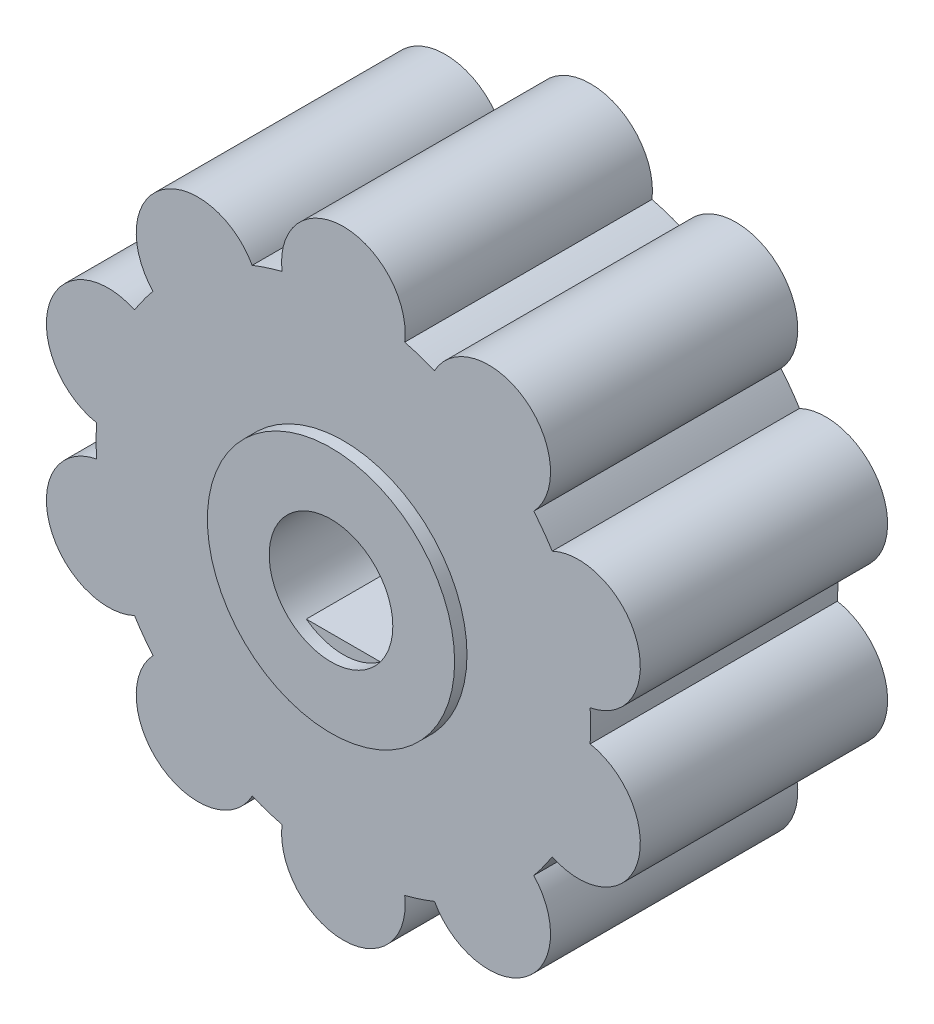
from build123d import *

# Parameters (mm, degrees)
SKIZZE1_R                            = 10
AUFSATZ_LINEAR_AUSTRAGEN1_DEPTH      = 10
AUFSATZ_LINEAR_AUSTRAGEN4_DEPTH      = 0.5
AUFSATZ_LINEAR_AUSTRAGEN4_DEPTH_BACK = 10.5
SKIZZE5_R                            = 5
SKIZZE2_R                            = 2.5
AUFSATZ_LINEAR_AUSTRAGEN2_DEPTH      = 10
KREISMUSTER1_COUNT                   = 10
SCHNITT_LINEAR_AUSTRAGEN1_DEPTH      = 0.5
SCHNITT_LINEAR_AUSTRAGEN1_DEPTH_BACK = 20
SKIZZE3_R                            = 2.5
SKIZZE4_W                            = 3.121683878
SKIZZE4_H                            = 1.135727963
AUFSATZ_LINEAR_AUSTRAGEN3_DEPTH      = 10


with BuildPart() as part:
    # Skizze1 → Aufsatz-Linear austragen1 (new body)
    with BuildSketch(Plane.XY):
        Circle(SKIZZE1_R)
    extrude(amount=AUFSATZ_LINEAR_AUSTRAGEN1_DEPTH)

    # Skizze5 → Aufsatz-Linear austragen4 (add, two sides: drawn at the far end of the back side and taken through both)
    with BuildSketch(Plane.XY.offset(10).offset(-AUFSATZ_LINEAR_AUSTRAGEN4_DEPTH_BACK)):
        Circle(SKIZZE5_R)
    extrude(amount=AUFSATZ_LINEAR_AUSTRAGEN4_DEPTH + AUFSATZ_LINEAR_AUSTRAGEN4_DEPTH_BACK)

    # Skizze2 → Aufsatz-Linear austragen2 (add)
    with BuildSketch(Plane(origin=(0, 0, 0), x_dir=(-1, 0, 0), z_dir=(0, 0, -1))):
        with Locations((0, 10)):
            Circle(SKIZZE2_R)
    aufsatz_linear_austragen2 = extrude(amount=-AUFSATZ_LINEAR_AUSTRAGEN2_DEPTH)

    # Kreismuster1: Aufsatz-Linear austragen2 ×10 about axis
    kreismuster1_axis = Axis((0, 0, 0), (0, 0, 1))
    for i in range(1, KREISMUSTER1_COUNT):
        add(aufsatz_linear_austragen2.rotate(kreismuster1_axis, i * 360 / KREISMUSTER1_COUNT))

    # Skizze3 → Schnitt-Linear austragen1 (cut, two sides: drawn at the far end of the back side and taken through both)
    with BuildSketch(Plane.XY.offset(10).offset(-SCHNITT_LINEAR_AUSTRAGEN1_DEPTH_BACK)):
        Circle(SKIZZE3_R)
    extrude(amount=SCHNITT_LINEAR_AUSTRAGEN1_DEPTH + SCHNITT_LINEAR_AUSTRAGEN1_DEPTH_BACK, mode=Mode.SUBTRACT)

    # Skizze4 → Aufsatz-Linear austragen3 (add)
    with BuildSketch(Plane.XY.offset(10)):
        with Locations((0.060841939, -2.567863982)):
            Rectangle(SKIZZE4_W, SKIZZE4_H)
    extrude(amount=-AUFSATZ_LINEAR_AUSTRAGEN3_DEPTH)


solid = part.part
